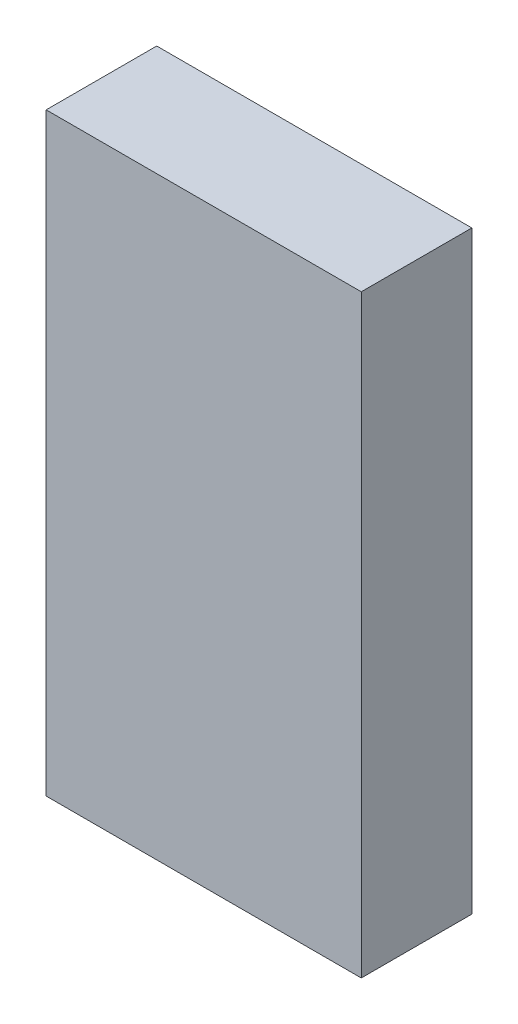
from build123d import *

# Parameters (mm, degrees)
SKETCH1_W           = 114
SKETCH1_H           = 215
BOSS_EXTRUDE1_DEPTH = 40
SKETCH2_R           = 2.5
CUT_EXTRUDE1_DEPTH  = 30


with BuildPart() as part:
    # Sketch1 → Boss-Extrude1 (new body)
    with BuildSketch(Plane.XY):
        Rectangle(SKETCH1_W, SKETCH1_H)
    extrude(amount=BOSS_EXTRUDE1_DEPTH)

    # Sketch2 → Cut-Extrude1 (cut)
    with BuildSketch(Plane(origin=(0, 0, 0), x_dir=(-1, 0, 0), z_dir=(0, 0, -1))):
        with Locations((-25, 75)):
            Circle(SKETCH2_R)
        with Locations((25, 75)):
            Circle(SKETCH2_R)
        with Locations((25, -75)):
            Circle(SKETCH2_R)
        with Locations((-25, -75)):
            Circle(SKETCH2_R)
    extrude(amount=-CUT_EXTRUDE1_DEPTH, mode=Mode.SUBTRACT)


solid = part.part
